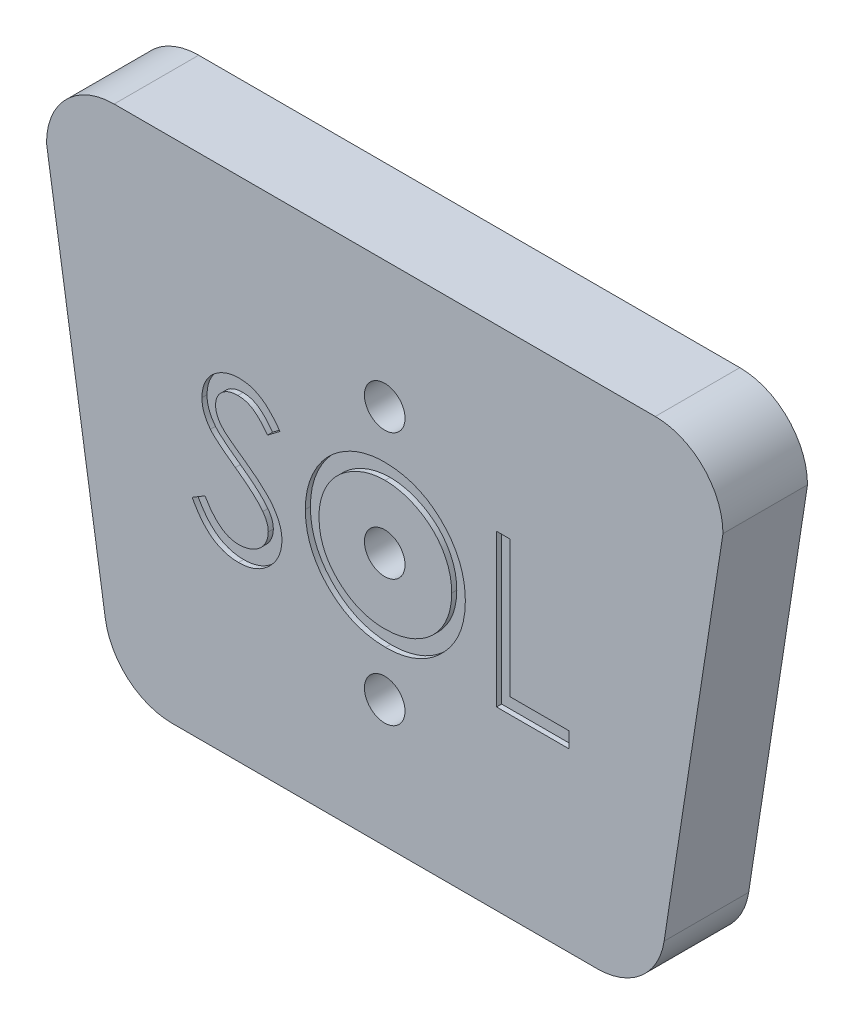
from build123d import *

# Parameters (mm, degrees)
BOSS_EXTRUDE1_DEPTH = 25
FILLET2_R           = 20
SKETCH10_R          = 6
CUT_EXTRUDE6_DEPTH  = 12
SKETCH11_R          = 3
CUT_EXTRUDE7_DEPTH  = 251.33777182
CUT_EXTRUDE8_DEPTH  = 1.5


with BuildPart() as part:
    # Sketch2 → Boss-Extrude1 (new body)
    with BuildSketch(Plane.XY):
        with BuildLine():
            Line((0, -20), (20, -150))
            Line((20, -150), (40, -150))
            Line((40, -150), (160, -150))
            Line((160, -150), (180, -150))
            Line((180, -150), (200, -20))
            ThreePointArc((200, -20), (194.142135624, -5.857864376), (180, 0))
            Line((180, 0), (160, 0))
            Line((160, 0), (40, 0))
            Line((40, 0), (20, 0))
            ThreePointArc((20, 0), (5.857864376, -5.857864376), (0, -20))
        make_face()
    extrude(amount=BOSS_EXTRUDE1_DEPTH)

    # Fillet2
    fillet2_edges = [part.edges().sort_by_distance(p)[0] for p in [
        (180, -150, 12.5),
        (20, -150, 12.5),
    ]]
    fillet(fillet2_edges, radius=FILLET2_R)

    # Sketch10 → Cut-Extrude6 (cut)
    with BuildSketch(Plane.XY.offset(25)):
        with Locations((100, -75)):
            Circle(SKETCH10_R)
        with Locations((100, -112.5)):
            Circle(SKETCH10_R)
        with Locations((100, -37.5)):
            Circle(SKETCH10_R)
    extrude(amount=-CUT_EXTRUDE6_DEPTH, mode=Mode.SUBTRACT)

    # Sketch11 → Cut-Extrude7 (cut, through all)
    with BuildSketch(Plane.XY.offset(13)):
        with Locations((100, -37.5)):
            Circle(SKETCH11_R)
        with Locations((100, -75)):
            Circle(SKETCH11_R)
        with Locations((100, -112.5)):
            Circle(SKETCH11_R)
    extrude(amount=-CUT_EXTRUDE7_DEPTH, mode=Mode.SUBTRACT)

    # Sketch13 → Cut-Extrude8 (cut)
    # profile 1 of 3: a face of its own
    with BuildSketch(Plane.XY.offset(25)):
        with BuildLine():
            Line((43.067502305, -89.17305103), (46.871588843, -86.892401992))
            add(Edge.make_bspline(
                [(46.871588843, -86.892401992), (47.225394751, -87.48465837), (47.903273216, -88.619398734), (49.034076405, -90.152716397), (50.205785263, -91.455944127), (51.427076694, -92.521500509), (52.690496027, -93.360414768), (54.004291004, -93.954443461), (55.364034284, -94.324934573), (56.289411989, -94.369935686), (56.751396536, -94.392401992)],
                knots=[0, 0, 0, 0, 1.272034388, 2.437168799, 3.508375237, 4.49857839, 5.41946034, 6.295179144, 7.148887113, 8, 8, 8, 8], degree=3))
            add(Edge.make_bspline(
                [(56.751396536, -94.392401992), (57.145941885, -94.381413345), (57.928128967, -94.359628328), (59.079643519, -94.15030373), (60.197980977, -93.828719215), (61.260092034, -93.368164382), (62.251321363, -92.810955279), (63.120550303, -92.137932997), (63.87200033, -91.384424638), (64.486688946, -90.543790507), (64.9582894, -89.639712882), (65.320758851, -88.711736365), (65.521909798, -87.745283344), (65.552210913, -87.094577393), (65.567502305, -86.766200069)],
                knots=[0, 0, 0, 0, 1.095163259, 2.171163733, 3.241058638, 4.321873601, 5.38011039, 6.391990106, 7.366004449, 8.327778327, 9.272591725, 10.192022065, 11.087607919, 12, 12, 12, 12], degree=3))
            add(Edge.make_bspline(
                [(65.567502305, -86.766200069), (65.548546882, -86.391532001), (65.510013276, -85.629886569), (65.184322818, -84.506176746), (64.671975358, -83.394129417), (64.199312797, -82.706256002), (63.953920574, -82.349132761)],
                knots=[0, 0, 0, 0, 0.938893495, 1.908633276, 2.914225137, 4, 4, 4, 4], degree=3))
            add(Edge.make_bspline(
                [(63.953920574, -82.349132761), (63.752441249, -82.091387886), (63.329460608, -81.550284762), (62.602292589, -80.74484602), (61.749013976, -79.914037776), (60.798825413, -79.026135616), (59.717114271, -78.122435372), (58.537760514, -77.159843227), (57.230653756, -76.174965808), (56.313945943, -75.514461394), (55.840939805, -75.173651992)],
                knots=[0, 0, 0, 0, 0.722233717, 1.516239348, 2.393582979, 3.351407094, 4.387010283, 5.505090956, 6.712668013, 8, 8, 8, 8], degree=3))
            add(Edge.make_bspline(
                [(55.840939805, -75.173651992), (55.367488425, -74.836427294), (54.462285441, -74.191679351), (53.196389382, -73.234795699), (52.064389143, -72.359945948), (51.071316074, -71.558894364), (50.217606971, -70.831532303), (49.496534544, -70.184844514), (48.926467381, -69.601341589), (48.609467059, -69.222810052), (48.467141728, -69.052858723)],
                knots=[0, 0, 0, 0, 1.452282411, 2.77665338, 3.964542531, 5.026858415, 5.96415736, 6.766646006, 7.446254459, 8, 8, 8, 8], degree=3))
            add(Edge.make_bspline(
                [(48.467141728, -69.052858723), (48.268209003, -68.787988249), (47.876981103, -68.267084915), (47.360561033, -67.452908172), (46.921628939, -66.619466188), (46.577541812, -65.764519358), (46.287790427, -64.900070272), (46.092902746, -64.014839971), (45.9708705, -63.11280059), (45.95837353, -62.505769868), (45.952117689, -62.201897184)],
                knots=[0, 0, 0, 0, 1.068054152, 2.10047183, 3.106115577, 4.101338837, 5.06977816, 6.043150881, 7.020423561, 8, 8, 8, 8], degree=3))
            add(Edge.make_bspline(
                [(45.952117689, -62.201897184), (45.968898948, -61.725800083), (46.002102777, -60.78378212), (46.282909428, -59.407671443), (46.726132346, -58.093846079), (47.347066619, -56.855313217), (48.147518299, -55.724322034), (49.073823684, -54.687862916), (50.177114221, -53.816552573), (51.387647949, -53.055254679), (52.712658447, -52.459378498), (54.101112919, -52.009880182), (55.555218131, -51.755189726), (56.540115576, -51.718639891), (57.039858074, -51.7000943)],
                knots=[0, 0, 0, 0, 1.005424448, 1.989358655, 2.955360095, 3.929531133, 4.905563448, 5.876582895, 6.856512386, 7.866279853, 8.892233794, 9.918561126, 10.94386622, 12, 12, 12, 12], degree=3))
            add(Edge.make_bspline(
                [(57.039858074, -51.7000943), (57.570139364, -51.718384249), (58.6246996, -51.75475712), (60.1759038, -52.071011094), (61.669398726, -52.594305446), (62.87081213, -53.18815962), (63.811090492, -53.781277822), (64.528168484, -54.321532705), (65.254821423, -54.943498387), (65.996910699, -55.648831551), (66.741862035, -56.444004065), (67.500734992, -57.323570066), (68.275304162, -58.282154355), (68.773593793, -58.966469365), (69.029040766, -59.3172818)],
                knots=[0, 0, 0, 0, 1.286793592, 2.559021753, 3.825965368, 5.121522368, 5.803751409, 6.523245864, 7.299691795, 8.125521123, 9.008227632, 9.944561021, 10.946284179, 12, 12, 12, 12], degree=3))
            Line((69.029040766, -59.3172818), (65.37819942, -62.084709684))
            add(Edge.make_bspline(
                [(65.37819942, -62.084709684), (65.157751717, -61.800712236), (64.733220983, -61.253799552), (64.088699009, -60.487882637), (63.481216393, -59.788242186), (62.882711253, -59.180547682), (62.324793134, -58.631520254), (61.783288305, -58.161466237), (61.265989504, -57.76578001), (60.613914938, -57.343505668), (59.794687131, -56.924922051), (58.766314522, -56.570719619), (57.691633843, -56.357868822), (56.959681439, -56.329725982), (56.58913692, -56.315478915)],
                knots=[0, 0, 0, 0, 1.181633172, 2.275549214, 3.290209073, 4.226197932, 5.078386478, 5.862611352, 6.581680152, 7.217281963, 8.414376989, 9.595101626, 10.782541182, 12, 12, 12, 12], degree=3))
            add(Edge.make_bspline(
                [(56.58913692, -56.315478915), (56.124267346, -56.331057914), (55.227810165, -56.361100547), (53.955078558, -56.689214644), (52.809585236, -57.205838562), (51.825337971, -57.92988828), (51.005862552, -58.787729615), (50.413078082, -59.774886323), (50.056290252, -60.864945785), (50.012752371, -61.625338509), (49.990579228, -62.0125943)],
                knots=[0, 0, 0, 0, 1.14458467, 2.207223713, 3.21896685, 4.227309161, 5.202851033, 6.127160689, 7.046193047, 8, 8, 8, 8], degree=3))
            add(Edge.make_bspline(
                [(49.990579228, -62.0125943), (49.995633713, -62.253684738), (50.005750949, -62.736259845), (50.146855491, -63.449206699), (50.328132577, -64.160352491), (50.615394985, -64.866499985), (51.01197746, -65.579998887), (51.532758294, -66.313135513), (52.188643734, -67.072371767), (52.691062464, -67.566180858), (52.95632442, -67.826897184)],
                knots=[0, 0, 0, 0, 0.858281714, 1.717966888, 2.583508476, 3.4729293, 4.427298488, 5.488583878, 6.674047936, 8, 8, 8, 8], degree=3))
            add(Edge.make_bspline(
                [(52.95632442, -67.826897184), (53.05482778, -67.914801802), (53.288849214, -68.123643052), (53.716682545, -68.465543803), (54.28166138, -68.887293732), (54.969032538, -69.409130659), (55.791470046, -70.014463743), (56.749064339, -70.695553042), (57.83114119, -71.474508944), (58.598994394, -72.019105894), (59.005002305, -72.307065453)],
                knots=[0, 0, 0, 0, 0.420754252, 0.999615792, 1.744751191, 2.668019286, 3.750313428, 4.999500688, 6.413464383, 8, 8, 8, 8], degree=3))
            add(Edge.make_bspline(
                [(59.005002305, -72.307065453), (59.493392619, -72.662454362), (60.439092772, -73.350615727), (61.784690228, -74.384531613), (63.004753475, -75.395717209), (64.103566092, -76.377715015), (65.091983487, -77.323076211), (65.959039895, -78.243174243), (66.713570071, -79.131417321), (67.525874309, -80.27020758), (68.355903417, -81.66882152), (69.068722798, -83.382398873), (69.518187265, -85.102637279), (69.576963892, -86.258839463), (69.605963843, -86.82930103)],
                knots=[0, 0, 0, 0, 1.163667725, 2.253281268, 3.268753668, 4.215851969, 5.092017293, 5.902905408, 6.650798638, 7.335211899, 8.59617414, 9.77448103, 10.901945474, 12, 12, 12, 12], degree=3))
            add(Edge.make_bspline(
                [(69.605963843, -86.82930103), (69.597514925, -87.232737153), (69.580781159, -88.031774941), (69.388426554, -89.205054501), (69.106602287, -90.344594254), (68.681837851, -91.436308557), (68.163397245, -92.500169792), (67.505545486, -93.508271369), (66.743018111, -94.482925065), (65.868298277, -95.398141382), (64.911136675, -96.238306759), (63.899489173, -96.985680407), (62.831699949, -97.608844564), (61.713561592, -98.117355391), (60.544817263, -98.515072045), (59.325860042, -98.803237505), (58.054680612, -98.980096645), (57.19067442, -98.998453578), (56.751396536, -99.007786607)],
                knots=[0, 0, 0, 0, 0.983748083, 1.948392443, 2.894712957, 3.844097841, 4.80183111, 5.778335162, 6.776009319, 7.81870978, 8.863265674, 9.881300176, 10.883814829, 11.87499822, 12.874611388, 13.892143829, 14.928324115, 16, 16, 16, 16], degree=3))
            add(Edge.make_bspline(
                [(56.751396536, -99.007786607), (56.411513554, -99.001214272), (55.736028068, -98.988152375), (54.736906158, -98.872678769), (53.757968583, -98.709301723), (52.811499242, -98.449920823), (51.88530395, -98.135216833), (50.983410934, -97.747723985), (50.105383099, -97.283359966), (49.246299891, -96.752423936), (48.408346218, -96.134538648), (47.59938163, -95.414879408), (46.79286353, -94.613294344), (46.012597006, -93.708015672), (45.242799437, -92.713668893), (44.498648457, -91.620950821), (43.764740658, -90.435813415), (43.304256072, -89.601833742), (43.067502305, -89.17305103)],
                knots=[0, 0, 0, 0, 0.915332311, 1.819136955, 2.706846663, 3.586547465, 4.459518054, 5.340707479, 6.227863349, 7.133153174, 8.059268498, 9.028702269, 10.047606654, 11.120612155, 12.245963614, 13.433783089, 14.680604001, 16, 16, 16, 16], degree=3))
        make_face()
    # profile 2 of 3: a face of its own
    with BuildSketch(Plane.XY.offset(25)):
        with BuildLine():
            add(Edge.make_bspline(
                [(99.894425382, -51.7000943), (100.727672458, -51.721199034), (102.364238461, -51.762650475), (104.769487146, -52.079953235), (107.0657098, -52.628893963), (109.271611585, -53.359989452), (111.360806998, -54.335260121), (113.34902133, -55.514069171), (115.231523993, -56.908766498), (116.982941756, -58.508570843), (118.585673974, -60.249215251), (119.997721083, -62.10678838), (121.181122002, -64.070058695), (122.152939266, -66.133126518), (122.915349962, -68.291326106), (123.441451952, -70.556163284), (123.777513883, -72.912963585), (123.816802449, -74.520451846), (123.836733074, -75.335911607)],
                knots=[0, 0, 0, 0, 1.065120563, 2.091984664, 3.0946048, 4.079830382, 5.057816894, 6.036188127, 7.030412546, 8.04752943, 9.064399622, 10.05169764, 11.02544977, 11.989514704, 12.962713494, 13.945757189, 14.957906945, 16, 16, 16, 16], degree=3))
            add(Edge.make_bspline(
                [(123.836733074, -75.335911607), (123.81680537, -76.145364489), (123.777525557, -77.740889895), (123.441069846, -80.082734177), (122.913399846, -82.333900274), (122.160019281, -84.490630096), (121.192834558, -86.555198773), (120.001553786, -88.522173894), (118.598309648, -90.392200302), (117.001364421, -92.144791712), (115.26049388, -93.751902049), (113.393247593, -95.152287594), (111.441619194, -96.357312053), (109.380494375, -97.318816433), (107.237208187, -98.087312553), (104.992578319, -98.611274939), (102.657122624, -98.949251209), (101.064495432, -98.9880607), (100.255002305, -99.007786607)],
                knots=[0, 0, 0, 0, 1.043624062, 2.057103931, 3.04512605, 4.022047818, 4.998200453, 5.980619268, 6.982898556, 8.009068085, 9.034988726, 10.034168286, 11.015286542, 11.987931943, 12.962482838, 13.94673481, 14.956375938, 16, 16, 16, 16], degree=3))
            add(Edge.make_bspline(
                [(100.255002305, -99.007786607), (99.439546775, -98.987865919), (97.832066856, -98.94859694), (95.472304972, -98.611978878), (93.205876837, -98.085590687), (91.03926375, -97.333326507), (88.971257512, -96.361104969), (86.997813592, -95.175620095), (85.126853128, -93.768956851), (83.373887816, -92.172529464), (81.769969553, -90.434609509), (80.371634723, -88.572454801), (79.185883266, -86.62259893), (78.216926134, -84.579630763), (77.449811657, -82.4534265), (76.926463995, -80.229803218), (76.587858897, -77.921438143), (76.548839442, -76.349743736), (76.529040766, -75.552257761)],
                knots=[0, 0, 0, 0, 1.053102029, 2.075944431, 3.073151272, 4.055350789, 5.033113405, 6.020478099, 7.024410459, 8.052272461, 9.079885166, 10.07527673, 11.055994387, 12.023226415, 12.992069828, 13.970394897, 14.97016774, 16, 16, 16, 16], degree=3))
            add(Edge.make_bspline(
                [(76.529040766, -75.552257761), (76.535914651, -75.016980587), (76.549575704, -73.953178999), (76.714040322, -72.373465568), (76.952690766, -70.819157111), (77.294715356, -69.294673494), (77.742036789, -67.803746548), (78.269848569, -66.336093883), (78.914503724, -64.906588864), (79.643254913, -63.508459542), (80.456621016, -62.163500752), (81.355023509, -60.892191826), (82.306906818, -59.683864725), (83.350436165, -58.569831818), (84.451219031, -57.517684807), (85.627112465, -56.543592731), (86.870941321, -55.638771933), (88.188057632, -54.823367548), (89.54600688, -54.08589296), (90.945851166, -53.45304059), (92.368578514, -52.909876942), (93.820852559, -52.469637761), (95.298816771, -52.122083013), (96.805696859, -51.885417036), (98.340292339, -51.720532949), (99.374152154, -51.706936495), (99.894425382, -51.7000943)],
                knots=[0, 0, 0, 0, 1.037015668, 2.060948919, 3.074880161, 4.083647147, 5.086022904, 6.090072063, 7.104153813, 8.122640571, 9.144368836, 10.147691507, 11.138137339, 12.123020368, 13.103399296, 14.087645067, 15.080126199, 16.082011238, 17.087798457, 18.072939717, 19.057185487, 20.037253025, 21.01195951, 21.997135196, 22.992090687, 24, 24, 24, 24], degree=3))
        make_face()
        with BuildLine():
            add(Edge.make_bspline(
                [(100.092742689, -56.315478915), (99.665697401, -56.320684647), (98.815689406, -56.331046343), (97.552031083, -56.467534115), (96.304991934, -56.662061259), (95.07431442, -56.939537954), (93.865147842, -57.317590062), (92.666221313, -57.752687453), (91.488467763, -58.282672903), (90.335775305, -58.881464816), (89.218295767, -59.544236655), (88.163846749, -60.276730803), (87.169698469, -61.061769357), (86.238285041, -61.901184409), (85.372341399, -62.799250718), (84.554823808, -63.742353468), (83.818500616, -64.75744921), (83.143686057, -65.817011584), (82.539813825, -66.919660486), (82.002830692, -68.053787286), (81.563579151, -69.228643259), (81.205348598, -70.431482428), (80.90835103, -71.660399766), (80.720200578, -72.924717823), (80.582213099, -74.218083549), (80.572443658, -75.092135958), (80.567502305, -75.534228915)],
                knots=[0, 0, 0, 0, 1.008559885, 2.007477868, 2.99961109, 3.989939068, 4.984837346, 5.991145699, 7.001802488, 8.033829008, 9.059044045, 10.069351652, 11.065060232, 12.050310815, 13.029377138, 14.011219647, 14.996725999, 15.989392538, 16.977580475, 17.965360261, 18.951710183, 19.937753436, 20.929683414, 21.935841486, 22.955955122, 24, 24, 24, 24], degree=3))
            add(Edge.make_bspline(
                [(80.567502305, -75.534228915), (80.583893387, -76.184314611), (80.616139717, -77.463234286), (80.898451333, -79.337396136), (81.33330529, -81.138531246), (81.974328573, -82.856784365), (82.775979332, -84.506925145), (83.766325065, -86.074315062), (84.939656165, -87.559377732), (86.272472935, -88.951745476), (87.729479163, -90.222620102), (89.276614262, -91.338149642), (90.897303501, -92.281995711), (92.59577325, -93.05091807), (94.362955895, -93.660214699), (96.210238694, -94.077797099), (98.125316032, -94.352624383), (99.430710169, -94.379016959), (100.092742689, -94.392401992)],
                knots=[0, 0, 0, 0, 1.032063989, 2.030389145, 3.003944642, 3.970395727, 4.937377036, 5.913328081, 6.909231446, 7.93887556, 8.970685674, 9.976071282, 10.964166581, 11.944589148, 12.933237628, 13.927779006, 14.949070134, 16, 16, 16, 16], degree=3))
            add(Edge.make_bspline(
                [(100.092742689, -94.392401992), (100.537721996, -94.386288364), (101.420249606, -94.374163205), (102.732906322, -94.25203736), (104.021914759, -94.056199039), (105.285466929, -93.774233466), (106.522128789, -93.421340812), (107.737061972, -93.002098596), (108.917325705, -92.479054548), (110.077809334, -91.901152314), (111.188618156, -91.242350288), (112.249017857, -90.534716936), (113.232280455, -89.750834669), (114.162997087, -88.923891365), (115.032495946, -88.037213321), (115.834897171, -87.091953326), (116.567498871, -86.082144876), (117.242057184, -85.024189659), (117.84381342, -83.918523553), (118.368116122, -82.780284837), (118.812923325, -81.612276288), (119.172004102, -80.412813226), (119.453388609, -79.184173742), (119.647273293, -77.924712737), (119.782896076, -76.636949762), (119.793118497, -75.765957328), (119.798271536, -75.326897184)],
                knots=[0, 0, 0, 0, 1.047197238, 2.076906641, 3.100256066, 4.114471768, 5.12198147, 6.126382909, 7.136867548, 8.15857795, 9.17633901, 10.174870724, 11.156907918, 12.133735059, 13.104061851, 14.077631395, 15.04955518, 16.038496417, 17.029181396, 18.010275684, 18.986308667, 19.968651475, 20.955262928, 21.950658345, 22.966943676, 24, 24, 24, 24], degree=3))
            add(Edge.make_bspline(
                [(119.798271536, -75.326897184), (119.793114369, -74.890840701), (119.782884178, -74.025842341), (119.647338076, -72.747060391), (119.453183771, -71.496661958), (119.173377525, -70.279555919), (118.812732691, -69.095432026), (118.368038443, -67.945402412), (117.843656022, -66.825182761), (117.241835994, -65.7375418), (116.565346835, -64.693866597), (115.826135135, -63.696121293), (115.011437802, -62.763043191), (114.144531768, -61.871597124), (113.203763242, -61.040795687), (112.193393747, -60.270363278), (111.125689318, -59.541706894), (109.995196291, -58.884378242), (108.828488315, -58.277338107), (107.631308855, -57.757253781), (106.417220432, -57.315326532), (105.189310416, -56.938394124), (103.937243552, -56.663148022), (102.669480038, -56.46735881), (101.387773856, -56.331093848), (100.525789603, -56.32070041), (100.092742689, -56.315478915)],
                knots=[0, 0, 0, 0, 1.02996197, 2.043119294, 3.035359645, 4.018872909, 4.991431989, 5.957985074, 6.929999688, 7.912076566, 8.892894881, 9.867085534, 10.843653904, 11.817741046, 12.803660682, 13.806313499, 14.818574707, 15.856120519, 16.894564902, 17.924820532, 18.937903209, 19.946497019, 20.957711757, 21.963978472, 22.977135795, 24, 24, 24, 24], degree=3))
        make_face(mode=Mode.SUBTRACT)
    # profile 3 of 3: a face of its own
    with BuildSketch(Plane.XY.offset(25)):
        Polygon((133.067502305, -52.853940453), (137.105963843, -52.853940453), (137.105963843, -93.238555838), (154.413656151, -93.238555838), (154.413656151, -97.853940453), (133.067502305, -97.853940453), align=None)
    extrude(amount=-CUT_EXTRUDE8_DEPTH, mode=Mode.SUBTRACT)


solid = part.part
